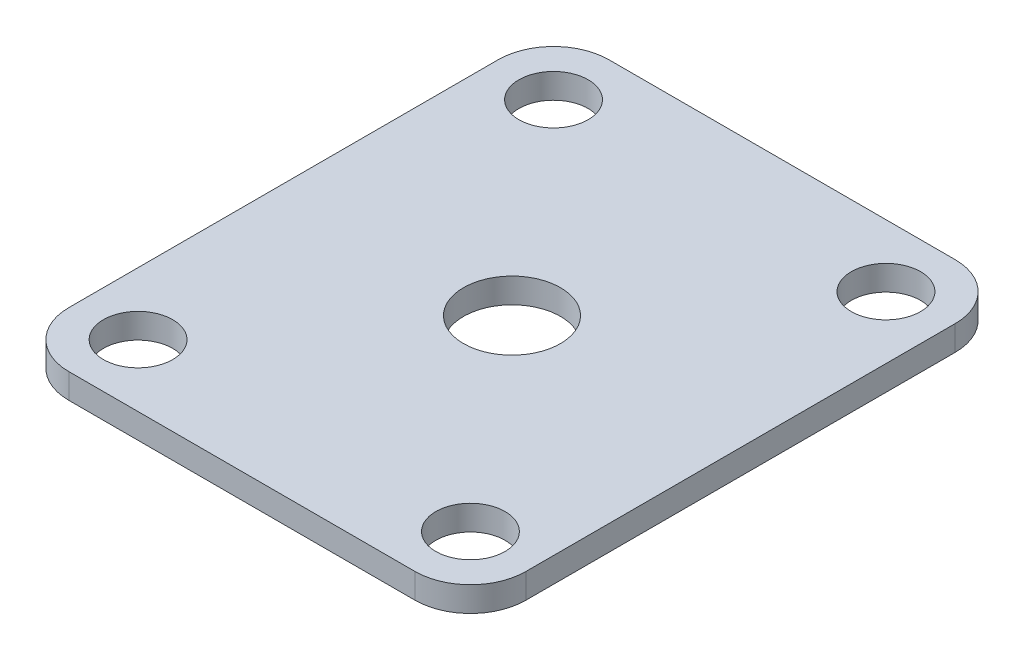
from build123d import *

# Parameters (mm, degrees)
SKETCH1_W           = 33
SKETCH1_H           = 39
SKETCH1_R           = 2.5
SKETCH1_R_2         = 3.5
BOSS_EXTRUDE1_DEPTH = 1.8
FILLET1_R           = 4
FILLET2_R           = 4
FILLET3_R           = 4
FILLET4_R           = 4


with BuildPart() as part:
    # Sketch1 → Boss-Extrude1 (new body)
    with BuildSketch(Plane(origin=(0, 0, 0), x_dir=(1, 0, 0), z_dir=(0, 1, 0))):
        Rectangle(SKETCH1_W, SKETCH1_H)
        with Locations(Location((12, -15, 0), (0, 0, 270))):
            Circle(SKETCH1_R, mode=Mode.SUBTRACT)
        with Locations(Location((12, 15, 0), (0, 0, 90))):
            Circle(SKETCH1_R, mode=Mode.SUBTRACT)
        with Locations(Location((-12, -15, 0), (0, 0, 90))):
            Circle(SKETCH1_R, mode=Mode.SUBTRACT)
        with Locations(Location((-12, 15, 0), (0, 0, 270))):
            Circle(SKETCH1_R, mode=Mode.SUBTRACT)
        with Locations(Location((0, 0, 0), (0, 0, 270))):
            Circle(SKETCH1_R_2, mode=Mode.SUBTRACT)
    extrude(amount=BOSS_EXTRUDE1_DEPTH)

    # Fillet1
    fillet1_edges = [part.edges().sort_by_distance(p)[0] for p in [
        (-16.5, 0.9, -19.5),
    ]]
    fillet(fillet1_edges, radius=FILLET1_R)

    # Fillet2
    fillet2_edges = [part.edges().sort_by_distance(p)[0] for p in [
        (16.5, 0.9, -19.5),
    ]]
    fillet(fillet2_edges, radius=FILLET2_R)

    # Fillet3
    fillet3_edges = [part.edges().sort_by_distance(p)[0] for p in [
        (16.5, 0.9, 19.5),
    ]]
    fillet(fillet3_edges, radius=FILLET3_R)

    # Fillet4
    fillet4_edges = [part.edges().sort_by_distance(p)[0] for p in [
        (-16.5, 0.9, 19.5),
    ]]
    fillet(fillet4_edges, radius=FILLET4_R)


solid = part.part
